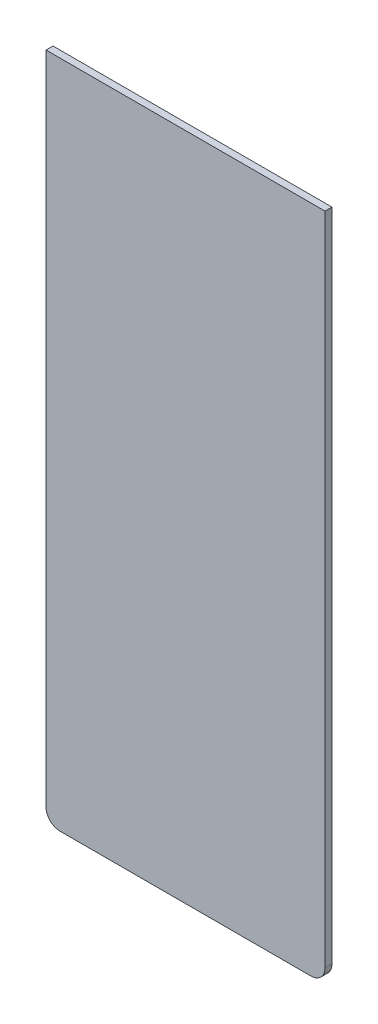
from build123d import *

# Parameters (mm, degrees)
SKETCH_1_W      = 200
SKETCH_1_H      = 480
EXTRUDE_1_DEPTH = 5
FILLET_1_R      = 10


with BuildPart() as part:
    # 草图1 → 凸台-拉伸1 (new body)
    with BuildSketch(Plane.XY):
        Rectangle(SKETCH_1_W, SKETCH_1_H)
    extrude(amount=EXTRUDE_1_DEPTH)

    # 圆角1
    fillet_1_edges = [part.edges().sort_by_distance(p)[0] for p in [
        (100, -240, 2.5),
        (-100, -240, 2.5),
    ]]
    fillet(fillet_1_edges, radius=FILLET_1_R)


solid = part.part
